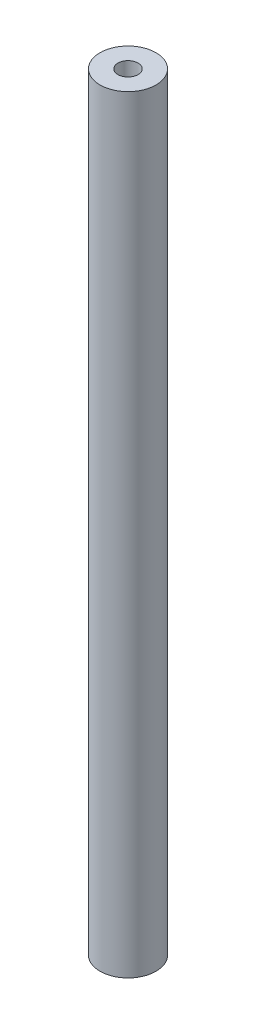
from build123d import *

# Parameters (mm, degrees)
SKETCH1_R           = 5.55625
BOSS_EXTRUDE1_DEPTH = 152.4
SKETCH2_R           = 2
CUT_EXTRUDE1_DEPTH  = 7
CUT_EXTRUDE2_START  = -7
SKETCH3_R           = 2
CUT_EXTRUDE2_DEPTH  = 7


with BuildPart() as part:
    # Sketch1 → Boss-Extrude1 (new body)
    with BuildSketch(Plane(origin=(0, 0, 0), x_dir=(1, 0, 0), z_dir=(0, 1, 0))):
        with Locations(Location((0, 0, 0), (0, 0, 90))):
            Circle(SKETCH1_R)
    extrude(amount=BOSS_EXTRUDE1_DEPTH)

    # Sketch2 → Cut-Extrude1 (cut)
    with BuildSketch(Plane(origin=(0, 152.4, 0), x_dir=(1, 0, 0), z_dir=(0, 1, 0))):
        with Locations(Location((0, 0, 0), (0, 0, 270))):
            Circle(SKETCH2_R)
    extrude(amount=-CUT_EXTRUDE1_DEPTH, mode=Mode.SUBTRACT)

    # Sketch3 → Cut-Extrude2 (cut)
    with BuildSketch(Plane.XZ.offset(CUT_EXTRUDE2_START)):
        with Locations(Location((0, 0, 0), (0, 0, 90))):
            Circle(SKETCH3_R)
    extrude(amount=CUT_EXTRUDE2_DEPTH, mode=Mode.SUBTRACT)


solid = part.part
